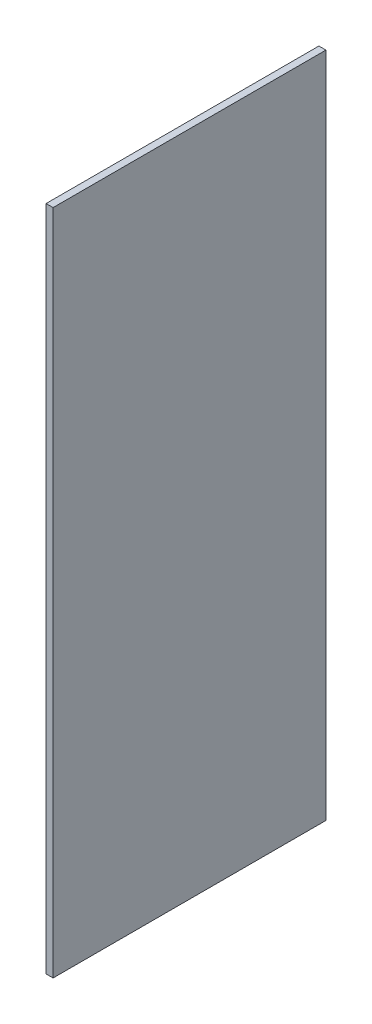
from build123d import *

# Parameters (mm, degrees)
SKETCH_1_W      = 95
SKETCH_1_H      = 38.85
EXTRUDE_1_DEPTH = 1
SKETCH_2_W      = 33.45
SKETCH_2_H      = 89.6
EXTRUDE_2_DEPTH = 0.5


with BuildPart() as part:
    # Эскиз1 → Бобышка-Вытянуть1 (new body)
    with BuildSketch(Plane(origin=(0.5, 0, 0), x_dir=(0, -1, 0), z_dir=(-1, 0, 0))):
        with Locations((-53.35, 22.825)):
            Rectangle(SKETCH_1_W, SKETCH_1_H)
    extrude(amount=-EXTRUDE_1_DEPTH)

    # Эскиз2 → Бобышка-Вытянуть2 (add)
    with BuildSketch(Plane.ZY.offset(-0.5)):
        with Locations((22.825, 53.35)):
            Rectangle(SKETCH_2_W, SKETCH_2_H)
    extrude(amount=EXTRUDE_2_DEPTH)


solid = part.part
